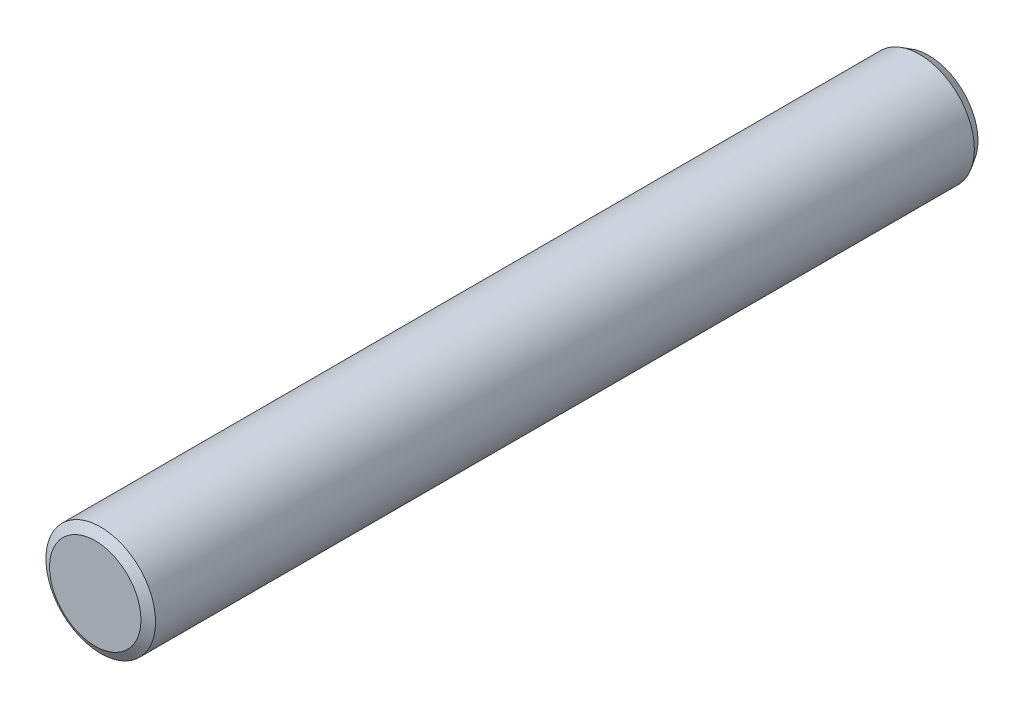
from build123d import *
from OCP.BRepFilletAPI import BRepFilletAPI_MakeChamfer

# Parameters (mm, degrees)
SCHIZZO1_R                   = 5
ESTRUSIONE_ESTRUSIONE1_DEPTH = 76
SMUSSO1_SIZE                 = 0.5
SMUSSO1_SIZE2                = 0.832139741


with BuildPart() as part:
    # Schizzo1 → Estrusione-Estrusione1 (new body)
    with BuildSketch(Plane.XY):
        Circle(SCHIZZO1_R)
    extrude(amount=ESTRUSIONE_ESTRUSIONE1_DEPTH)

    # Smusso1: one chamfer whose edges measure the first distance from different faces: ONE call of the kernel's chamfer builder (chamfer() names one face for all edges)
    smusso1_edges_1 = [part.edges().sort_by_distance(p)[0] for p in [
        (-5, 0, 0),
    ]]
    smusso1_side_1 = [part.faces().sort_by_distance(p)[0] for p in [
        (0, 0, 0),
    ]]
    smusso1_edges_2 = [part.edges().sort_by_distance(p)[0] for p in [
        (-5, 0, 76),
    ]]
    smusso1_side_2 = [part.faces().sort_by_distance(p)[0] for p in [
        (-5, 0, 38),
    ]]
    smusso1 = BRepFilletAPI_MakeChamfer(part.part.solid().wrapped)
    for e in smusso1_edges_1:
        smusso1.Add(SMUSSO1_SIZE, SMUSSO1_SIZE2, e.wrapped, smusso1_side_1[0].wrapped)  # the first distance lies on this face
    for e in smusso1_edges_2:
        smusso1.Add(SMUSSO1_SIZE, SMUSSO1_SIZE2, e.wrapped, smusso1_side_2[0].wrapped)  # the first distance lies on this face
    add(Compound.cast(smusso1.Shape()), mode=Mode.REPLACE)


solid = part.part
